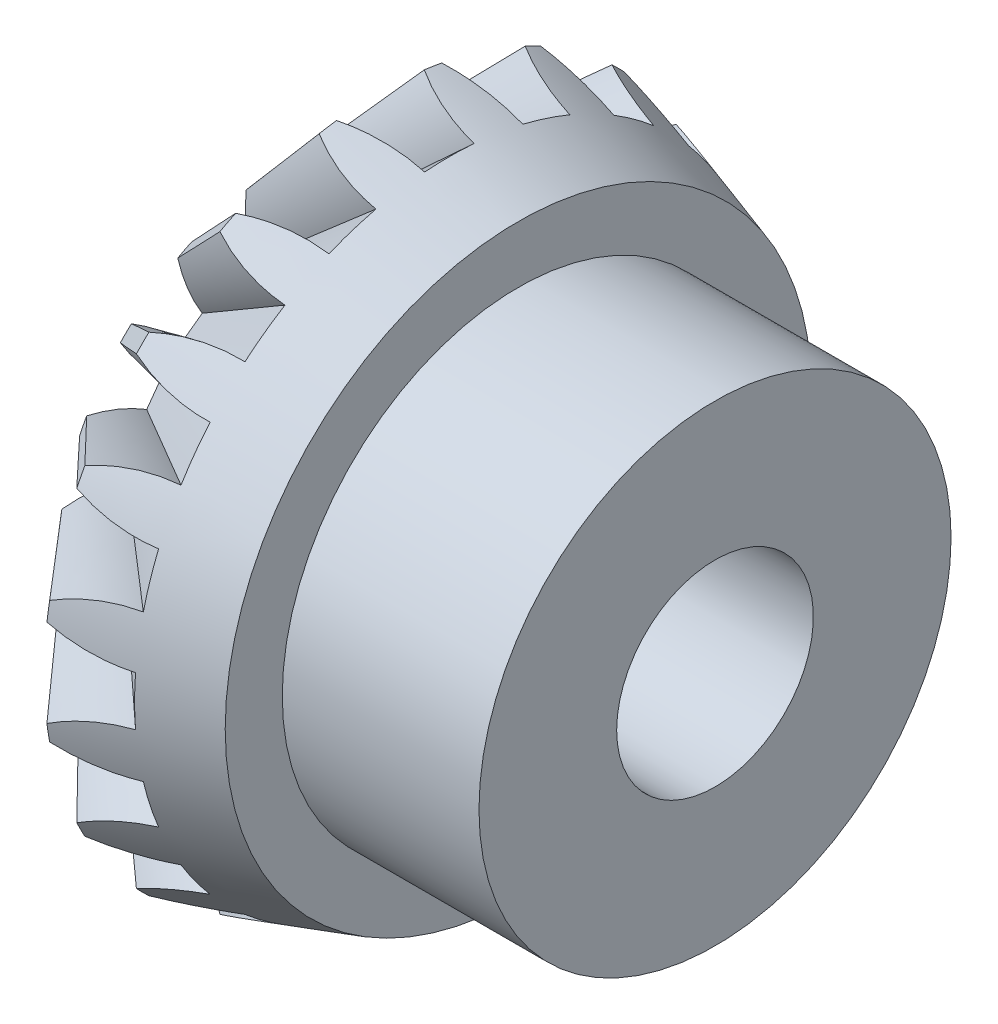
from build123d import *

# Parameters (mm, degrees)
CIRPATTERN1_COUNT = 20


with BuildPart() as part:
    # Sketch1 → Revolve1 (revolve)
    with BuildSketch(Plane.XY, mode=Mode.PRIVATE) as revolve1_sk:
        Polygon((0, 2.5), (10.8, 2.5), (10.8, 6), (5.8, 6), (5.8, 7.45), (2.295591838, 8.55), (0, 5.907982189), align=None)
    revolve(revolve1_sk.sketch.rotate(Axis((0, 0, 0), (1, 0, 0)), 90), axis=Axis((0, 0, 0), (1, 0, 0)))

    # Sketch6 for Cut-Loft1 → Cut-Loft1 section 0
    with BuildSketch(Plane(origin=(4.047795919, 0, 0), x_dir=(0, 0, -1), z_dir=(1, 0, 0))):
        with BuildLine():
            Line((-4.167095104, 12.825), (4.167095104, 12.825))
            # circular arc as an exact rational Bezier (weights 1, cos(half-angle), 1)
            Bezier((4.167095104, 12.825), (0.904273504, 11.489884277), (0.627672766, 7.97533867), weights=[1, 0.851516128, 1])
            Bezier((0.627672766, 7.97533867), (0, 8.024737588), (-0.627672766, 7.97533867), weights=[1, 0.996917334, 1])
            Bezier((-0.627672766, 7.97533867), (-0.904273504, 11.489884277), (-4.167095104, 12.825), weights=[1, 0.851516128, 1])
        make_face()
    # Sketch5 for Cut-Loft1 → Cut-Loft1 section 1
    with BuildSketch(Plane.ZY):
        with BuildLine():
            Line((-0.335412634, 4.261821602), (0.335412634, 4.261821602))
            Bezier((0.335412634, 4.261821602), (0.532547617, 6.766659059), (2.642095302, 8.131533214), weights=[1, 0.896497279, 1])
            Bezier((2.642095302, 8.131533214), (0, 8.990002017), (-2.642095302, 8.131533214), weights=[1, 0.951056516, 1])
            Bezier((-2.642095302, 8.131533214), (-0.532547617, 6.766659059), (-0.335412634, 4.261821602), weights=[1, 0.896497279, 1])
        make_face()
    cut_loft1 = loft(mode=Mode.SUBTRACT)

    # CirPattern1: Cut-Loft1 ×20 about axis
    cirpattern1_axis = Axis((0, 0, 0), (-1, 0, 0))
    for i in range(1, CIRPATTERN1_COUNT):
        add(cut_loft1.rotate(cirpattern1_axis, i * 360 / CIRPATTERN1_COUNT), mode=Mode.SUBTRACT)


solid = part.part
